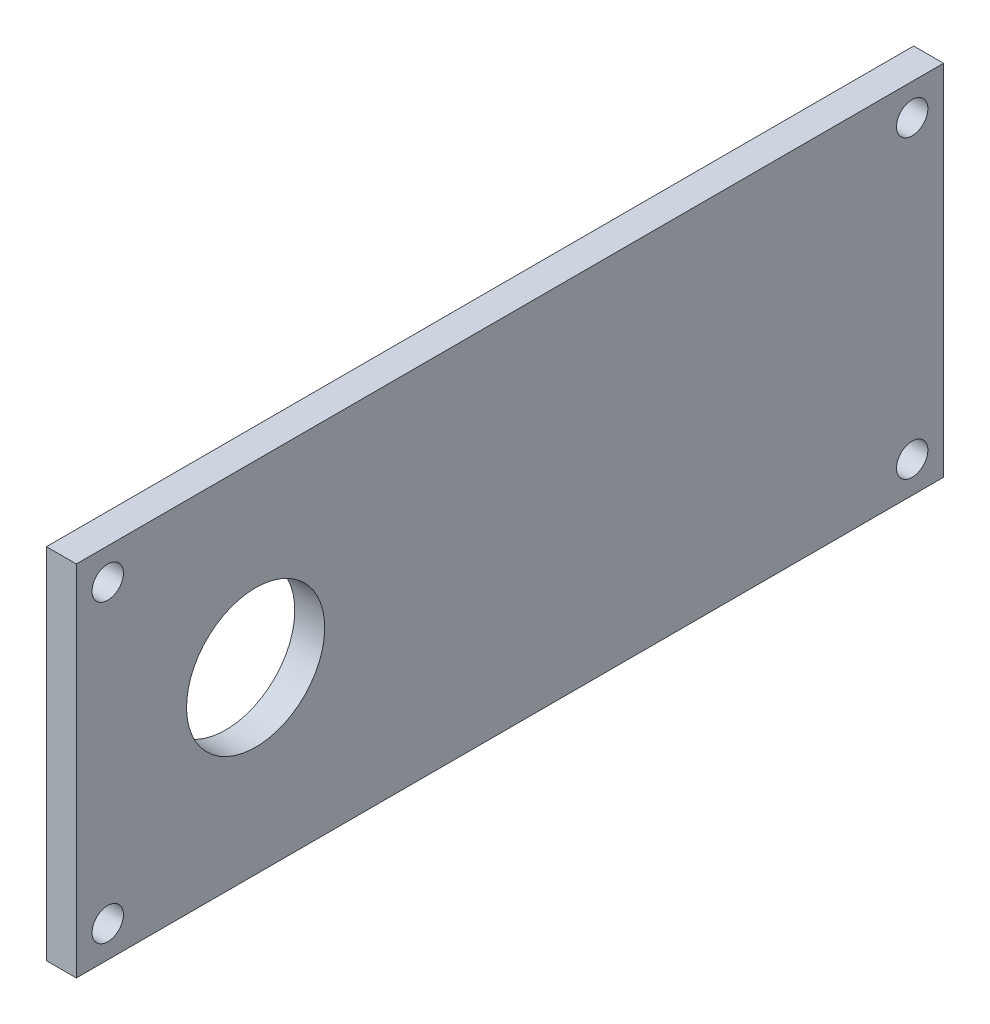
from build123d import *

# Parameters (mm, degrees)
SKETCH1_W           = 138.1
SKETCH1_H           = 57.1
SKETCH1_R           = 2.5
SKETCH1_R_2         = 11
BOSS_EXTRUDE1_DEPTH = 4.7625


with BuildPart() as part:
    # Sketch1 → Boss-Extrude1 (new body)
    with BuildSketch(Plane.ZY.offset(82.970238089)):
        with Locations((-89.208048627, -51.057798632)):
            Rectangle(SKETCH1_W, SKETCH1_H)
        with Locations(Location((-153.258048627, -27.507798632, 0), (0, 0, 90))):
            Circle(SKETCH1_R, mode=Mode.SUBTRACT)
        with Locations(Location((-153.258048627, -74.607798632, 0), (0, 0, 90))):
            Circle(SKETCH1_R, mode=Mode.SUBTRACT)
        with Locations(Location((-25.158048627, -27.507798632, 0), (0, 0, 90))):
            Circle(SKETCH1_R, mode=Mode.SUBTRACT)
        with Locations(Location((-25.158048627, -74.607798632, 0), (0, 0, 90))):
            Circle(SKETCH1_R, mode=Mode.SUBTRACT)
        with Locations(Location((-48.708048627, -51.057798632, 0), (0, 0, 90))):
            Circle(SKETCH1_R_2, mode=Mode.SUBTRACT)
    extrude(amount=BOSS_EXTRUDE1_DEPTH)


solid = part.part
